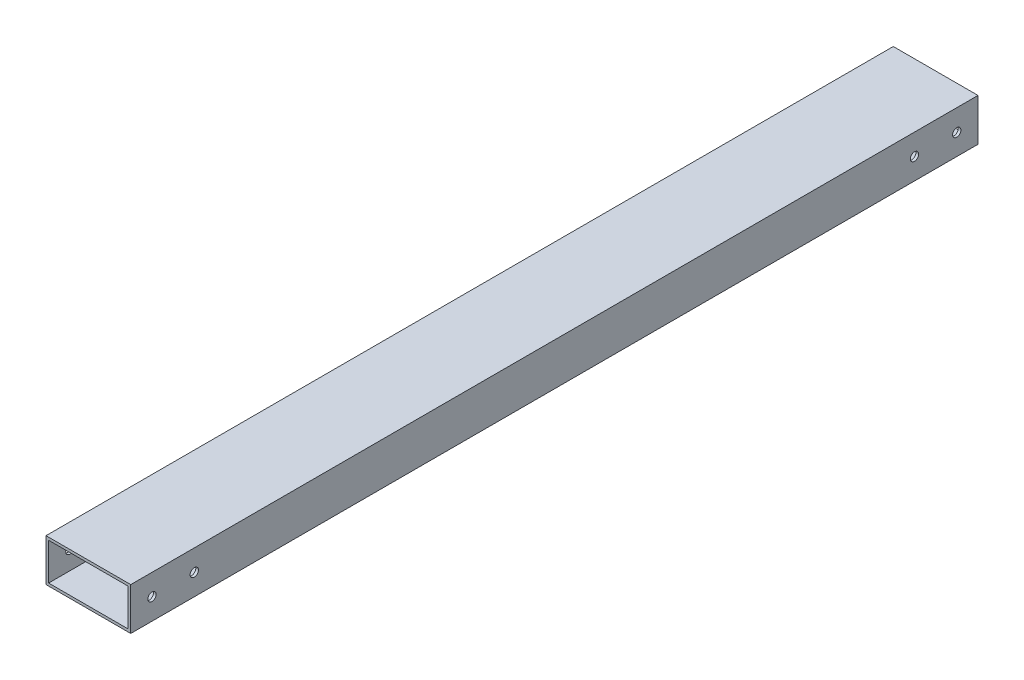
from build123d import *

# Parameters (mm, degrees)
BOSS_EXTRUDE1_DEPTH      = 254.000001
BOSS_EXTRUDE1_DEPTH_BACK = 254.000001
SKETCH3_W                = 50.8
SKETCH3_H                = 25.4
SKETCH3_W_2              = 47.625
SKETCH3_H_2              = 22.225
F_10_CLEARANCE_HOLE1_D   = 4.9784


with BuildPart() as part:
    # Sketch3 → Boss-Extrude1 (new, two sides: drawn at the far end of the back side and taken through both)
    with BuildSketch(Plane.XY.offset(-BOSS_EXTRUDE1_DEPTH_BACK)):
        Rectangle(SKETCH3_W, SKETCH3_H)
        Rectangle(SKETCH3_W_2, SKETCH3_H_2, mode=Mode.SUBTRACT)
    extrude(amount=BOSS_EXTRUDE1_DEPTH + BOSS_EXTRUDE1_DEPTH_BACK)

    # #10 Clearance Hole1 (through all)
    with Locations(Plane(origin=(25.4, 0, 0), x_dir=(0, 0, -1), z_dir=(1, 0, 0))):
        with Locations((-215.900000508, 0), (-241.261771093, 0), (215.899999492, 0), (241.261770077, -0.163454089)):
            Hole(F_10_CLEARANCE_HOLE1_D / 2)


solid = part.part
